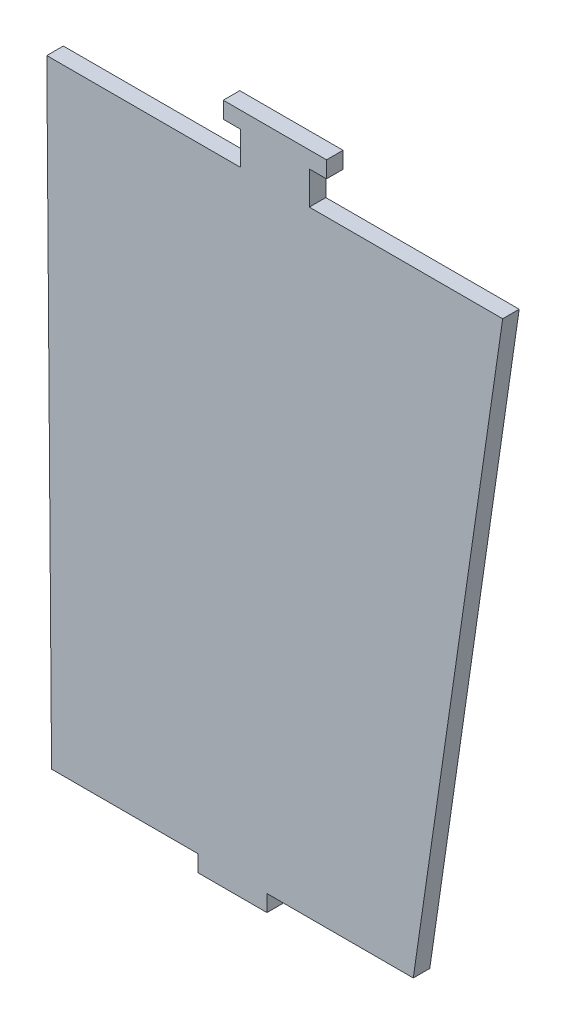
from build123d import *

# Parameters (mm, degrees)
BOSS_EXTRUDE1_DEPTH = 1.524


with BuildPart() as part:
    # Sketch1 → Boss-Extrude1 (new body)
    with BuildSketch(Plane.XY):
        Polygon((-105.044408822, -1.524), (-113.29304893, -58.314338926), (-126.787898899, -58.314338926), (-126.787898899, -59.838338926), (-133.137898899, -59.838338926), (-133.137898899, -58.314338926), (-146.65932572, -58.314338926), (-147.099210905, -1.524), (-129.233521437, -1.524), (-129.233521437, 1.524), (-130.821021437, 1.524), (-130.821021437, 3.048), (-121.296021437, 3.048), (-121.296021437, 1.524), (-122.883521437, 1.524), (-122.883521437, -1.524), align=None)
    extrude(amount=BOSS_EXTRUDE1_DEPTH)


solid = part.part
